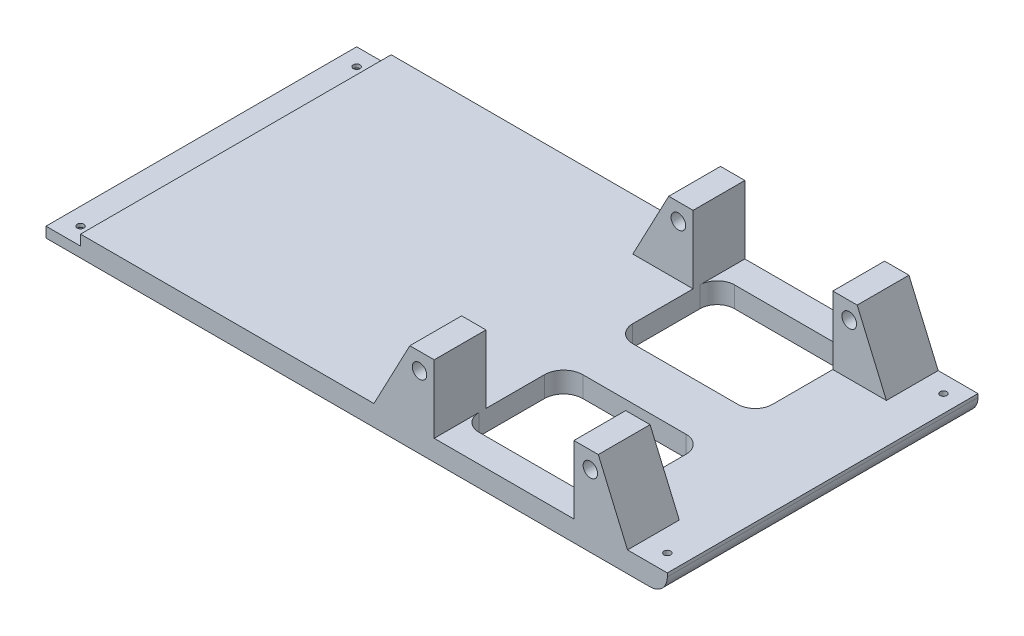
from build123d import *

# Parameters (mm, degrees)
SKIZZE2_W                       = 180
SKIZZE2_H                       = 90
AUFSATZ_LINEAR_AUSTRAGEN1_DEPTH = 6
SKIZZE3_W                       = 10
SKIZZE3_H                       = 90
SCHNITT_LINEAR_AUSTRAGEN1_DEPTH = 3
SKIZZE4_R                       = 2.125
AUFSATZ_LINEAR_AUSTRAGEN2_DEPTH = 15
SKIZZE5_R                       = 2.1
AUFSATZ_LINEAR_AUSTRAGEN3_DEPTH = 15
VERRUNDUNG1_R                   = 5
SCHNITT_LINEAR_AUSTRAGEN2_DEPTH = 10
SKIZZE7_R                       = 0.975
SCHNITT_LINEAR_AUSTRAGEN3_DEPTH = 10
SKIZZE8_R                       = 3.25
SCHNITT_LINEAR_AUSTRAGEN4_DEPTH = 2


with BuildPart() as part:
    # Skizze2 → Aufsatz-Linear austragen1 (new body)
    with BuildSketch(Plane(origin=(0, 0, 0), x_dir=(1, 0, 0), z_dir=(0, 1, 0))):
        with Locations((90, 45)):
            Rectangle(SKIZZE2_W, SKIZZE2_H)
    extrude(amount=AUFSATZ_LINEAR_AUSTRAGEN1_DEPTH)

    # Skizze3 → Schnitt-Linear austragen1 (cut)
    with BuildSketch(Plane(origin=(0, 6, 0), x_dir=(1, 0, 0), z_dir=(0, 1, 0))):
        with Locations((5, 45)):
            Rectangle(SKIZZE3_W, SKIZZE3_H)
    extrude(amount=-SCHNITT_LINEAR_AUSTRAGEN1_DEPTH, mode=Mode.SUBTRACT)

    # Skizze4 → Aufsatz-Linear austragen2 (add)
    # profile 1 of 2: a face of its own
    with BuildSketch(Plane(origin=(0, 0, -90), x_dir=(-1, 0, 0), z_dir=(0, 0, -1))):
        Polygon((-160, 0), (-152.94, 0), (-152.94, 25.7), (-160, 25.7), (-168.464332067, 6), (-160, 6), align=None)
        with Locations((-157.7, 20.78)):
            Circle(SKIZZE4_R, mode=Mode.SUBTRACT)
    # profile 2 of 2: a face of its own
    with BuildSketch(Plane(origin=(0, 0, -90), x_dir=(-1, 0, 0), z_dir=(0, 0, -1))):
        Polygon((-105.4, 25.7), (-95, 6), (-105.4, 6), (-105.4, 0), (-112.46, 0), (-112.46, 25.7), align=None)
        with Locations((-108.2, 20.78)):
            Circle(SKIZZE4_R, mode=Mode.SUBTRACT)
    extrude(amount=-AUFSATZ_LINEAR_AUSTRAGEN2_DEPTH)

    # Skizze5 → Aufsatz-Linear austragen3 (add)
    # profile 1 of 2: a face of its own
    with BuildSketch(Plane.XY):
        Polygon((105.4, 25.7), (95, 6), (105.4, 6), (112.46, 6), (112.46, 25.7), align=None)
        with Locations((108.2, 20.78)):
            Circle(SKIZZE5_R, mode=Mode.SUBTRACT)
    # profile 2 of 2: a face of its own
    with BuildSketch(Plane.XY):
        Polygon((160, 25.7), (152.94, 25.7), (152.94, 6), (160, 6), (168.464332067, 6), align=None)
        with Locations((157.7, 20.78)):
            Circle(SKIZZE5_R, mode=Mode.SUBTRACT)
    extrude(amount=-AUFSATZ_LINEAR_AUSTRAGEN3_DEPTH)

    # Verrundung1
    verrundung1_edges = [part.edges().sort_by_distance(p)[0] for p in [
        (180, 0, -45),
    ]]
    fillet(verrundung1_edges, radius=VERRUNDUNG1_R)

    # Skizze6 → Schnitt-Linear austragen2 (cut)
    with BuildSketch(Plane(origin=(0, 0, 0), x_dir=(-1, 0, 0), z_dir=(0, -1, 0))):
        with BuildLine():
            Line((-117.46, 8), (-147.94, 8))
            ThreePointArc((-147.94, 8), (-151.475533906, 9.464466094), (-152.94, 13))
            Line((-152.94, 13), (-152.94, 32.5))
            ThreePointArc((-152.94, 32.5), (-151.475533906, 36.035533906), (-147.94, 37.5))
            Line((-147.94, 37.5), (-132.970987797, 37.5))
            Line((-132.970987797, 37.5), (-118.04, 37.5))
            ThreePointArc((-118.04, 37.5), (-114.094344161, 35.865655839), (-112.46, 31.92))
            Line((-112.46, 31.92), (-112.46, 13))
            ThreePointArc((-112.46, 13), (-113.924466094, 9.464466094), (-117.46, 8))
        make_face()
        with BuildLine():
            Line((-117.46, 82), (-147.94, 82))
            ThreePointArc((-147.94, 82), (-151.475533906, 80.535533906), (-152.94, 77))
            Line((-152.94, 77), (-152.94, 57.5))
            ThreePointArc((-152.94, 57.5), (-151.475533906, 53.964466094), (-147.94, 52.5))
            Line((-147.94, 52.5), (-117.46, 52.5))
            ThreePointArc((-117.46, 52.5), (-113.924466094, 53.964466094), (-112.46, 57.5))
            Line((-112.46, 57.5), (-112.46, 77))
            ThreePointArc((-112.46, 77), (-113.924466094, 80.535533906), (-117.46, 82))
        make_face()
    extrude(amount=-SCHNITT_LINEAR_AUSTRAGEN2_DEPTH, mode=Mode.SUBTRACT)

    # Skizze7 → Schnitt-Linear austragen3 (cut)
    with BuildSketch(Plane.XZ):
        with Locations((5, -5)):
            Circle(SKIZZE7_R)
        with Locations((5, -85)):
            Circle(SKIZZE7_R)
        with Locations((175, -85)):
            Circle(SKIZZE7_R)
        with Locations((175, -5)):
            Circle(SKIZZE7_R)
    extrude(amount=-SCHNITT_LINEAR_AUSTRAGEN3_DEPTH, mode=Mode.SUBTRACT)

    # Skizze8 → Schnitt-Linear austragen4 (cut)
    with BuildSketch(Plane.XZ):
        with Locations((5, -5)):
            Circle(SKIZZE8_R)
        with Locations((5, -85)):
            Circle(SKIZZE8_R)
        with Locations((175, -85)):
            Circle(SKIZZE8_R)
        with Locations((175, -5)):
            Circle(SKIZZE8_R)
    extrude(amount=-SCHNITT_LINEAR_AUSTRAGEN4_DEPTH, mode=Mode.SUBTRACT)


solid = part.part
